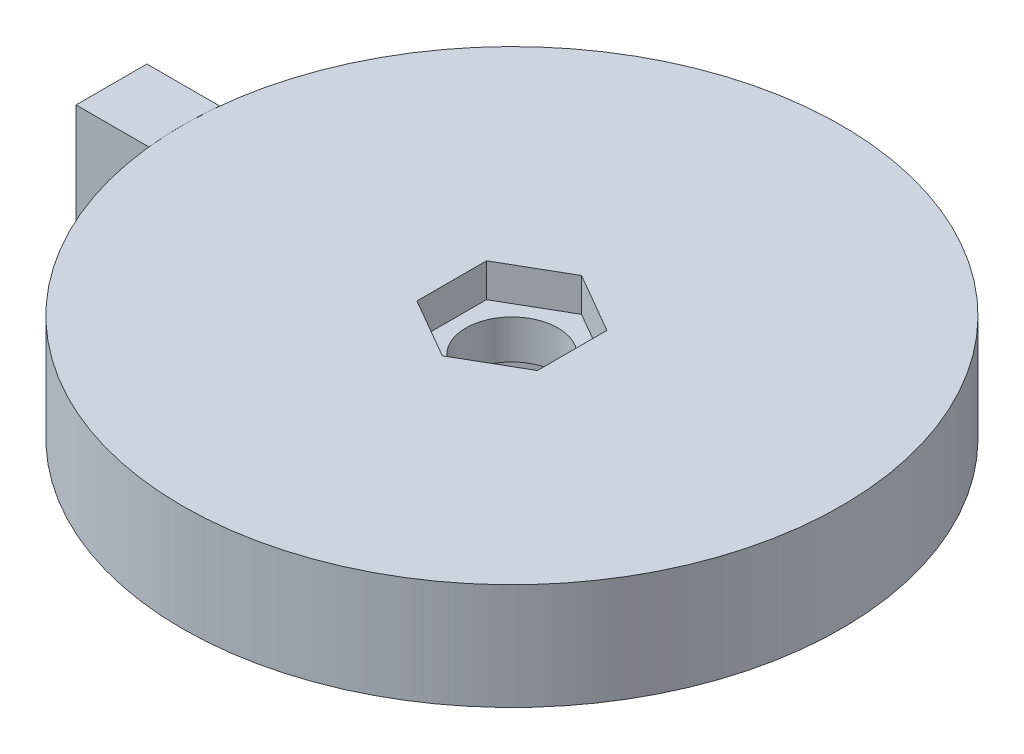
from build123d import *

# Parameters (mm, degrees)
ESQUISSE1_R             = 46.5
BOSS_EXTRU_1_DEPTH      = 15
BOSS_EXTRU_2_DEPTH      = 15
ESQUISSE3_R             = 6.5
ENL_V_MAT_EXTRU_1_DEPTH = 75.696050766
ENL_V_MAT_EXTRU_3_DEPTH = 4.75
ENL_V_MAT_EXTRU_4_DEPTH = 4.75


with BuildPart() as part:
    # Esquisse1 → Boss.-Extru.1 (new body)
    with BuildSketch(Plane(origin=(0, 0, 0), x_dir=(1, 0, 0), z_dir=(0, 1, 0))):
        with Locations(Location((0, 0, 0), (0, 0, 270))):
            Circle(ESQUISSE1_R)
    extrude(amount=BOSS_EXTRU_1_DEPTH)

    # Esquisse3 → Enlèv. mat.-Extru.1 (cut, through all)
    with BuildSketch(Plane(origin=(0, 15, 0), x_dir=(1, 0, 0), z_dir=(0, 1, 0))):
        with Locations(Location((0, 0, 0), (0, 0, 270))):
            Circle(ESQUISSE3_R)
    extrude(amount=-ENL_V_MAT_EXTRU_1_DEPTH, mode=Mode.SUBTRACT)

    # Esquisse4 → Enlèv. mat.-Extru.3 (cut)
    with BuildSketch(Plane(origin=(0, 15, 0), x_dir=(1, 0, 0), z_dir=(0, 1, 0))):
        Polygon((4.25, 7.361215932), (0, 9.814954576), (-4.25, 7.361215932), (-8.5, 4.907477288), (-8.5, 0), (-8.5, -4.907477288), (-4.25, -7.361215932), (0, -9.814954576), (4.25, -7.361215932), (8.5, -4.907477288), (8.5, 0), (8.5, 4.907477288), align=None)
    extrude(amount=-ENL_V_MAT_EXTRU_3_DEPTH, mode=Mode.SUBTRACT)

    # Esquisse5 → Enlèv. mat.-Extru.4 (cut)
    with BuildSketch(Plane.XZ):
        Polygon((-8.5, 4.907477288), (0, 9.814954576), (8.5, 4.907477288), (8.5, -4.907477288), (0, -9.814954576), (-8.5, -4.907477288), align=None)
    extrude(amount=-ENL_V_MAT_EXTRU_4_DEPTH, mode=Mode.SUBTRACT)


with BuildPart() as body_2:
    # Esquisse2 → Boss.-Extru.2 (new body)
    with BuildSketch(Plane.XZ):
        with BuildLine():
            ThreePointArc((-46.230401253, -5), (-46.432551396, -2.503631537), (-46.5, 0))
            Line((-46.5, 0), (-56.5, 0))
            Line((-56.5, 0), (-56.5, -5))
            Line((-56.5, -5), (-46.230401253, -5))
        make_face()
        with BuildLine():
            Line((-56.5, 0), (-46.5, 0))
            ThreePointArc((-46.5, 0), (-46.432551396, 2.503631537), (-46.230401253, 5))
            Line((-46.230401253, 5), (-56.5, 5))
            Line((-56.5, 5), (-56.5, 0))
        make_face()
    extrude(amount=-BOSS_EXTRU_2_DEPTH)


solid = Compound([part.part, body_2.part])
